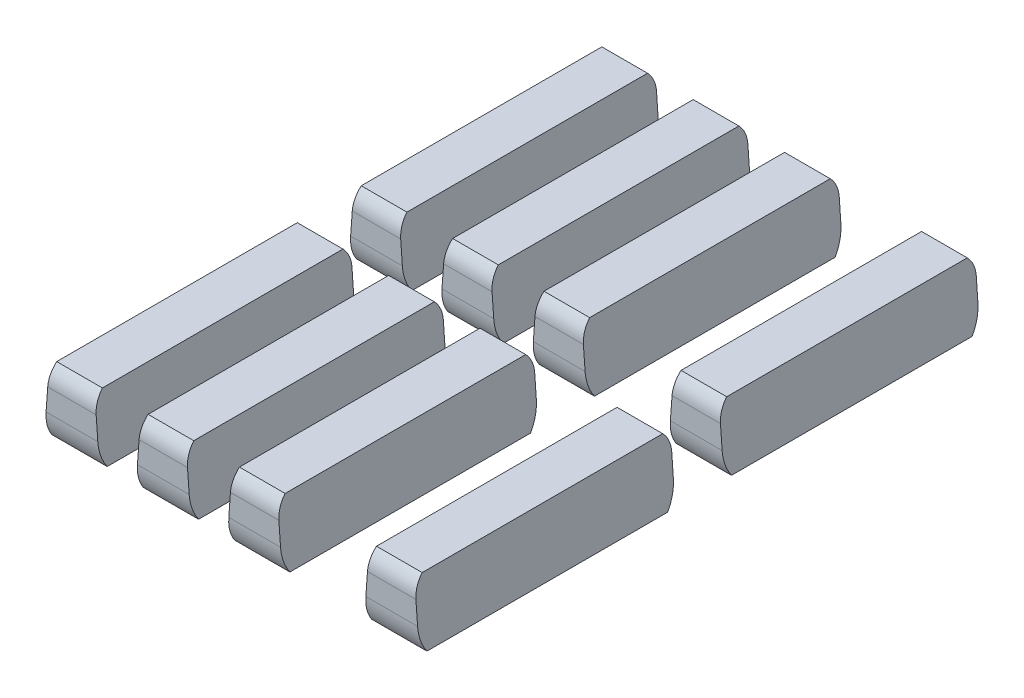
from build123d import *

# Parameters (mm, degrees)
BOSS_EXTRUDE1_START   = -11.05
BOSS_EXTRUDE1_DEPTH   = 22.1
BOSS_EXTRUDE1_2_DEPTH = 22.1
BOSS_EXTRUDE1_3_DEPTH = 22.1
BOSS_EXTRUDE1_4_DEPTH = 22.1
CUT_EXTRUDE5_START    = -0.001745
CUT_EXTRUDE5_DEPTH    = 22.859465734


with BuildPart() as part:
    # Sketch2 → Boss-Extrude1 (new body)
    with BuildSketch(Plane.XY.offset(BOSS_EXTRUDE1_START)):
        Polygon((5.998255481, -4.5), (6.156194078, -2.34403522), (7.656194078, -2.34403522), (7.814132676, -4.5), align=None)
    extrude(amount=BOSS_EXTRUDE1_DEPTH)


with BuildPart() as body_2:
    # Sketch2 → Boss-Extrude1 2 (new body)
    with BuildSketch(Plane.XY.offset(BOSS_EXTRUDE1_START)):
        Polygon((10.656194078, -2.34403522), (9.156194078, -2.34403522), (8.998255481, -4.5), (10.814132676, -4.5), align=None)
    extrude(amount=BOSS_EXTRUDE1_2_DEPTH)


with BuildPart() as body_3:
    # Sketch2 → Boss-Extrude1 3 (new body)
    with BuildSketch(Plane.XY.offset(BOSS_EXTRUDE1_START)):
        Polygon((12.156194078, -2.34403522), (13.656194078, -2.34403522), (13.814132676, -4.5), (11.998255481, -4.5), align=None)
    extrude(amount=BOSS_EXTRUDE1_3_DEPTH)


with BuildPart() as body_4:
    # Sketch2 → Boss-Extrude1 4 (new body)
    with BuildSketch(Plane.XY.offset(BOSS_EXTRUDE1_START)):
        Polygon((18.156194078, -2.34403522), (16.656194078, -2.34403522), (16.498255481, -4.5), (18.314132676, -4.5), align=None)
    extrude(amount=BOSS_EXTRUDE1_4_DEPTH)


with BuildPart() as cut_extrude5_tool:
    # Sketch3 → Cut-Extrude5 (new, through all)
    with BuildSketch(Plane(origin=(0, 0, 0), x_dir=(0, 0, -1), z_dir=(1, 0, 0)).offset(CUT_EXTRUDE5_START)):
        with BuildLine():
            Line((-8.95, -4.5), (-11.05, -4.5))
            Line((-11.05, -4.5), (-11.05, -2.34403522))
            Line((-11.05, -2.34403522), (-8.95, -2.34403522))
            ThreePointArc((-8.95, -2.34403522), (-9.135123882, -2.628018904), (-9.2, -2.960748033))
            Line((-9.2, -2.960748033), (-9.2, -3.7))
            ThreePointArc((-9.2, -3.7), (-9.136044369, -4.119076365), (-8.95, -4.5))
        make_face()
        with BuildLine():
            Line((-1.05, -4.5), (1.05, -4.5))
            ThreePointArc((1.05, -4.5), (0.863955631, -4.119076365), (0.8, -3.7))
            Line((0.8, -3.7), (0.8, -2.960748033))
            ThreePointArc((0.8, -2.960748033), (0.864876118, -2.628018904), (1.05, -2.34403522))
            Line((1.05, -2.34403522), (-1.05, -2.34403522))
            ThreePointArc((-1.05, -2.34403522), (-0.864876118, -2.628018904), (-0.8, -2.960748033))
            Line((-0.8, -2.960748033), (-0.8, -3.7))
            ThreePointArc((-0.8, -3.7), (-0.863955631, -4.119076365), (-1.05, -4.5))
        make_face()
        with BuildLine():
            Line((8.95, -4.5), (11.05, -4.5))
            Line((11.05, -4.5), (11.05, -2.34403522))
            Line((11.05, -2.34403522), (8.95, -2.34403522))
            ThreePointArc((8.95, -2.34403522), (9.135123882, -2.628018904), (9.2, -2.960748033))
            Line((9.2, -2.960748033), (9.2, -3.7))
            ThreePointArc((9.2, -3.7), (9.136044369, -4.119076365), (8.95, -4.5))
        make_face()
    extrude(amount=CUT_EXTRUDE5_DEPTH)


with BuildPart() as part_1:
    add(part.part)

    # Cut-Extrude5: cut by cut_extrude5_tool
    add(cut_extrude5_tool.part, mode=Mode.SUBTRACT)


with BuildPart() as body_2_1:
    add(body_2.part)

    # Cut-Extrude5: cut by cut_extrude5_tool
    add(cut_extrude5_tool.part, mode=Mode.SUBTRACT)


with BuildPart() as body_3_1:
    add(body_3.part)

    # Cut-Extrude5: cut by cut_extrude5_tool
    add(cut_extrude5_tool.part, mode=Mode.SUBTRACT)


with BuildPart() as body_4_1:
    add(body_4.part)

    # Cut-Extrude5: cut by cut_extrude5_tool
    add(cut_extrude5_tool.part, mode=Mode.SUBTRACT)


with BuildPart() as cut_extrude5_piece_1:
    # of the separate pieces the step leaves, piece 1, a body of its own (cut_extrude5_pieces)
    add(part_1.part.solids().sort_by_distance((6.056860741, -3.7, 0.8))[0])


with BuildPart() as cut_extrude5_piece_2:
    # of the separate pieces the step leaves, piece 2, a body of its own (cut_extrude5_pieces)
    add(part_1.part.solids().sort_by_distance((6.056860741, -3.7, -9.2))[0])


with BuildPart() as cut_extrude5_piece_1_of_body_2:
    # of the separate pieces the step leaves, piece 1, a body of its own (cut_extrude5_pieces_of_body_2)
    add(body_2_1.part.solids().sort_by_distance((9.156194078, -2.34403522, -8.95))[0])


with BuildPart() as cut_extrude5_piece_2_of_body_2:
    # of the separate pieces the step leaves, piece 2, a body of its own (cut_extrude5_pieces_of_body_2)
    add(body_2_1.part.solids().sort_by_distance((9.156194078, -2.34403522, 1.05))[0])


with BuildPart() as cut_extrude5_piece_1_of_body_3:
    # of the separate pieces the step leaves, piece 1, a body of its own (cut_extrude5_pieces_of_body_3)
    add(body_3_1.part.solids().sort_by_distance((12.156194078, -2.34403522, -8.95))[0])


with BuildPart() as cut_extrude5_piece_2_of_body_3:
    # of the separate pieces the step leaves, piece 2, a body of its own (cut_extrude5_pieces_of_body_3)
    add(body_3_1.part.solids().sort_by_distance((12.156194078, -2.34403522, 1.05))[0])


with BuildPart() as cut_extrude5_piece_1_of_body_4:
    # of the separate pieces the step leaves, piece 1, a body of its own (cut_extrude5_pieces_of_body_4)
    add(body_4_1.part.solids().sort_by_distance((16.656194078, -2.34403522, -8.95))[0])


with BuildPart() as cut_extrude5_piece_2_of_body_4:
    # of the separate pieces the step leaves, piece 2, a body of its own (cut_extrude5_pieces_of_body_4)
    add(body_4_1.part.solids().sort_by_distance((16.656194078, -2.34403522, 1.05))[0])


solid = Compound([cut_extrude5_piece_1.part, cut_extrude5_piece_2.part, cut_extrude5_piece_1_of_body_2.part, cut_extrude5_piece_2_of_body_2.part, cut_extrude5_piece_1_of_body_3.part, cut_extrude5_piece_2_of_body_3.part, cut_extrude5_piece_1_of_body_4.part, cut_extrude5_piece_2_of_body_4.part])
